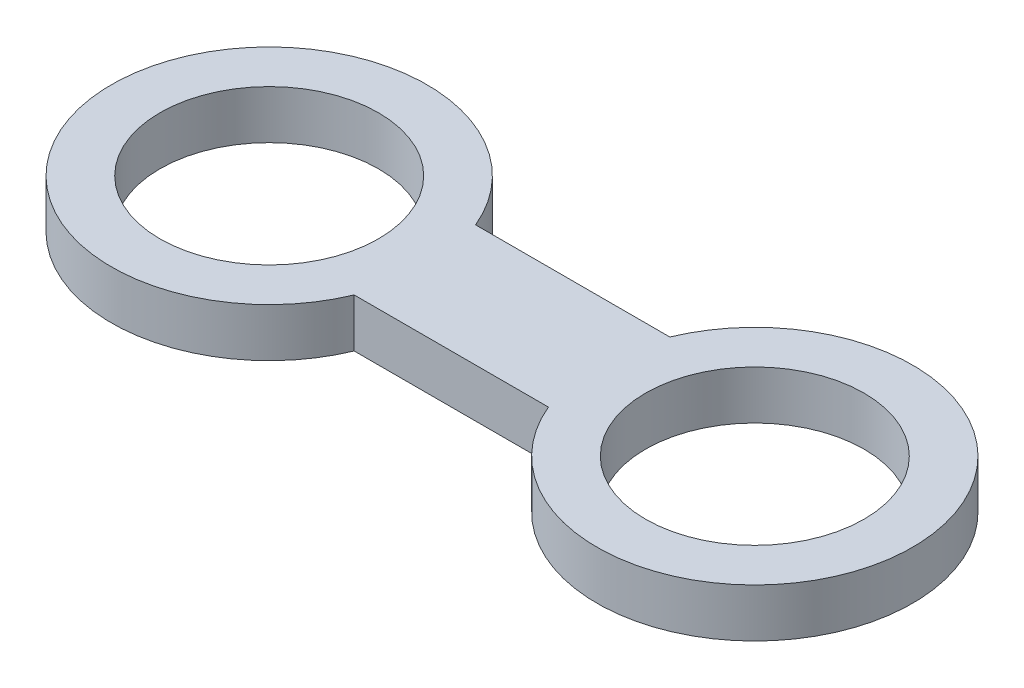
from build123d import *

# Parameters (mm, degrees)
RESSALTO_EXTRUS_O1_DEPTH = 2
ESBO_O2_R                = 4.5
CORTE_EXTRUS_O1_DEPTH    = 2


with BuildPart() as part:
    # Esboço1 → Ressalto-extrusão1 (new body)
    with BuildSketch(Plane(origin=(0, 0, 0), x_dir=(1, 0, 0), z_dir=(0, 1, 0))):
        with BuildLine():
            Line((6, -2.5), (14, -2.5))
            ThreePointArc((14, -2.5), (26.5, 0), (14, 2.5))
            Line((14, 2.5), (6, 2.5))
            ThreePointArc((6, 2.5), (-6.5, 0), (6, -2.5))
        make_face()
    extrude(amount=-RESSALTO_EXTRUS_O1_DEPTH)

    # Esboço2 → Corte-extrusão1 (cut)
    with BuildSketch(Plane(origin=(0, 0, 0), x_dir=(1, 0, 0), z_dir=(0, 1, 0))):
        with Locations(Location((0, 0, 0), (0, 0, 270))):
            Circle(ESBO_O2_R)
        with Locations(Location((20, 0, 0), (0, 0, 270))):
            Circle(ESBO_O2_R)
    extrude(amount=-CORTE_EXTRUS_O1_DEPTH, mode=Mode.SUBTRACT)


solid = part.part
